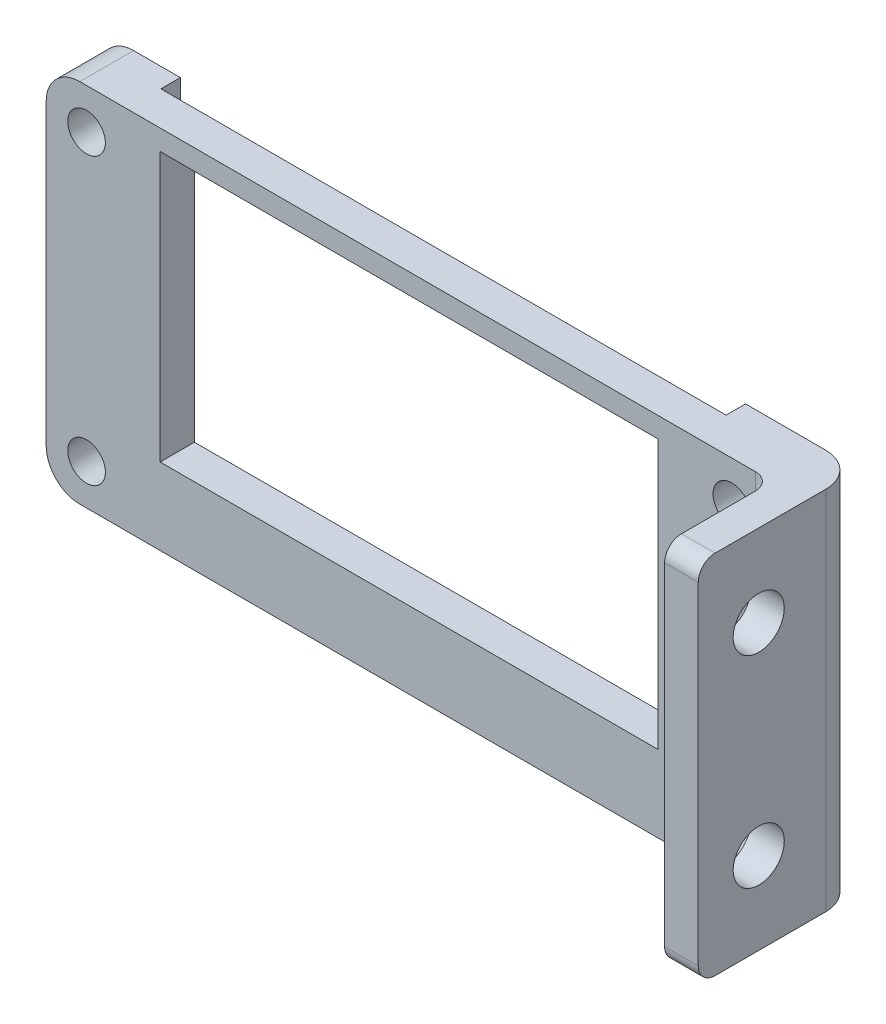
from build123d import *

# Parameters (mm, degrees)
BOSS_EXTRUDE1_DEPTH        = 27.22
CUT_EXTRUDE1_DEPTH         = 36.045677694
CUT_EXTRUDE1_DEPTH_BACK    = 2.5
SKETCH1_W                  = 37.05
SKETCH1_H                  = 20
F_2_8_2_8_DIAMETER_HOLE1_D = 2.8
FILLET3_R                  = 2.5
FILLET4_R                  = 1.25
F_3_8_3_8_DIAMETER_HOLE1_D = 3.8
FILLET5_R                  = 1.25


with BuildPart() as part:
    # Sketch2 → Boss-Extrude1 (new body)
    with BuildSketch(Plane(origin=(0, 11.515, 0), x_dir=(1, 0, 0), z_dir=(0, 1, 0))):
        Polygon((-27, 1.45), (-21.02, 1.45), (-21.02, 0), (21.02, 0), (21.02, 1.45), (29.5, 1.45), (29.5, -10.55), (27, -10.55), (27, -2.55), (-27, -2.55), align=None)
    extrude(amount=-BOSS_EXTRUDE1_DEPTH)

    # Sketch1 → Cut-Extrude1 (cut, two sides: drawn at the far end of the back side and taken through both)
    with BuildSketch(Plane.XY.offset(-CUT_EXTRUDE1_DEPTH_BACK)):
        Rectangle(SKETCH1_W, SKETCH1_H)
    extrude(amount=CUT_EXTRUDE1_DEPTH + CUT_EXTRUDE1_DEPTH_BACK, mode=Mode.SUBTRACT)

    # Ø2.8 (2.8) Diameter Hole1 (through all)
    with Locations(Plane.XY.offset(2.55)):
        with Locations((24, -12.705), (-24, -12.705), (-24, 8.515), (24, 8.515)):
            Hole(F_2_8_2_8_DIAMETER_HOLE1_D / 2)

    # Fillet3
    fillet3_edges = [part.edges().sort_by_distance(p)[0] for p in [
        (-27, 11.515, 0.55),
        (29.5, -2.095, -1.45),
        (-27, -15.705, 0.55),
    ]]
    fillet(fillet3_edges, radius=FILLET3_R)

    # Fillet4
    fillet4_edges = [part.edges().sort_by_distance(p)[0] for p in [
        (27, -2.095, 2.55),
    ]]
    fillet(fillet4_edges, radius=FILLET4_R)

    # Ø3.8 (3.8) Diameter Hole1 (through all)
    with Locations(Plane(origin=(29.5, 0, 0), x_dir=(0, 0, -1), z_dir=(1, 0, 0))):
        with Locations((-6.05, -9.595), (-6.05, 5.405)):
            Hole(F_3_8_3_8_DIAMETER_HOLE1_D / 2)

    # Fillet5
    fillet5_edges = [part.edges().sort_by_distance(p)[0] for p in [
        (28.25, 11.515, 10.55),
        (28.25, -15.705, 10.55),
    ]]
    fillet(fillet5_edges, radius=FILLET5_R)


solid = part.part
